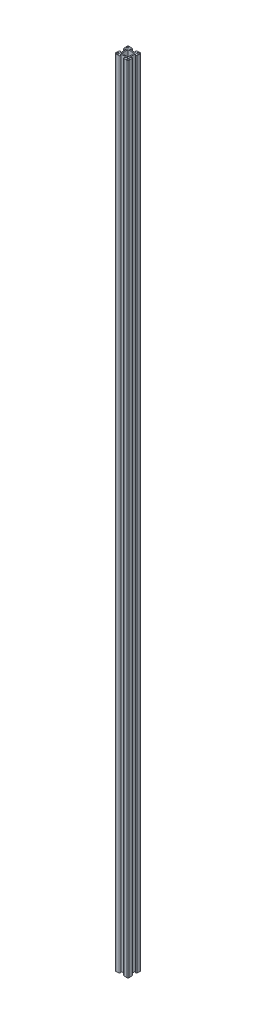
from build123d import *

# Parameters (mm, degrees)
BOSS_EXTRUDE1_DEPTH = 1510
FILLET1_R           = 2.032
FILLET2_R           = 1.27
SKETCH5_W           = 12.048677603
SKETCH5_H           = 11.996966541
SKETCH5_R           = 1.809887194
SKETCH5_R_2         = 1.778
SKETCH5_R_3         = 1.784780941
CUT_EXTRUDE3_DEPTH  = 1511.155598371
SCALE1_SCALE        = 0.8


with BuildPart() as part:
    # Sketch2 → Boss-Extrude1 (new body)
    with BuildSketch(Plane(origin=(0, 0, 0), x_dir=(1, 0, 0), z_dir=(0, 1, 0))):
        Polygon((-11.631944508, 4.856112595), (-11.631944508, -8.62647921), (-15.607851567, -2.645315933), (-16.258611825, -14.593573265), (-4.310354494, -13.942813006), (-10.340832945, -9.861953178), (3.339587632, -9.861953178), (-2.854456203, -13.936328227), (9.141388175, -14.593573265), (8.484143137, -2.597728887), (4.461618468, -8.47589662), (4.461618468, 4.675168062), (8.490627916, 0), (9.141388175, 10.806426735), (-1.66503856, 10.155666477), (3.011955341, 6.231609797), (-10.257604353, 6.231609797), (-4.292081103, 10.155666477), (-16.258611825, 10.806426735), (-15.607851567, -1.160103987), align=None)
    extrude(amount=BOSS_EXTRUDE1_DEPTH)

    # Fillet1
    fillet1_edges = [part.edges().sort_by_distance(p)[0] for p in [
        (9.141388175, 755, 14.593573265),
        (-16.258611825, 755, 14.593573265),
        (-16.258611825, 755, -10.806426735),
        (9.141388175, 755, -10.806426735),
    ]]
    fillet(fillet1_edges, radius=FILLET1_R)

    # Fillet2
    fillet2_edges = [part.edges().sort_by_distance(p)[0] for p in [
        (8.490627916, 755, 0),
        (8.484143137, 755, 2.597728887),
        (-2.854456203, 755, 13.936328227),
        (-4.310354494, 755, 13.942813006),
        (-15.607851567, 755, 2.645315933),
        (-15.607851567, 755, 1.160103987),
        (-4.292081103, 755, -10.155666477),
        (-1.66503856, 755, -10.155666477),
    ]]
    fillet(fillet2_edges, radius=FILLET2_R)

    # Sketch5 → Cut-Extrude3 (cut, through all)
    with BuildSketch(Plane(origin=(0, 1510, 0), x_dir=(1, 0, 0), z_dir=(0, 1, 0))):
        with Locations((-3.593458736, -1.901154881)):
            Rectangle(SKETCH5_W, SKETCH5_H)
        with Locations(Location((6.050654454, -11.415990413, 0), (0, 0, 270))):
            Circle(SKETCH5_R)
        with Locations(Location((-13.030727673, -11.545268069, 0), (0, 0, 270))):
            Circle(SKETCH5_R_2)
        with Locations(Location((-13.108294267, 7.613680652, 0), (0, 0, 270))):
            Circle(SKETCH5_R_2)
        with Locations(Location((5.921376797, 7.665391714, 0), (0, 0, 270))):
            Circle(SKETCH5_R_3)
    extrude(amount=-CUT_EXTRUDE3_DEPTH, mode=Mode.SUBTRACT)


with BuildPart() as part_1:
    # Scale1: scaled about (-3.644090286, 755, 1.930683285)
    add(part.part.scale(SCALE1_SCALE).moved(Location((-0.728818057, 151, 0.386136657))))


solid = part_1.part
